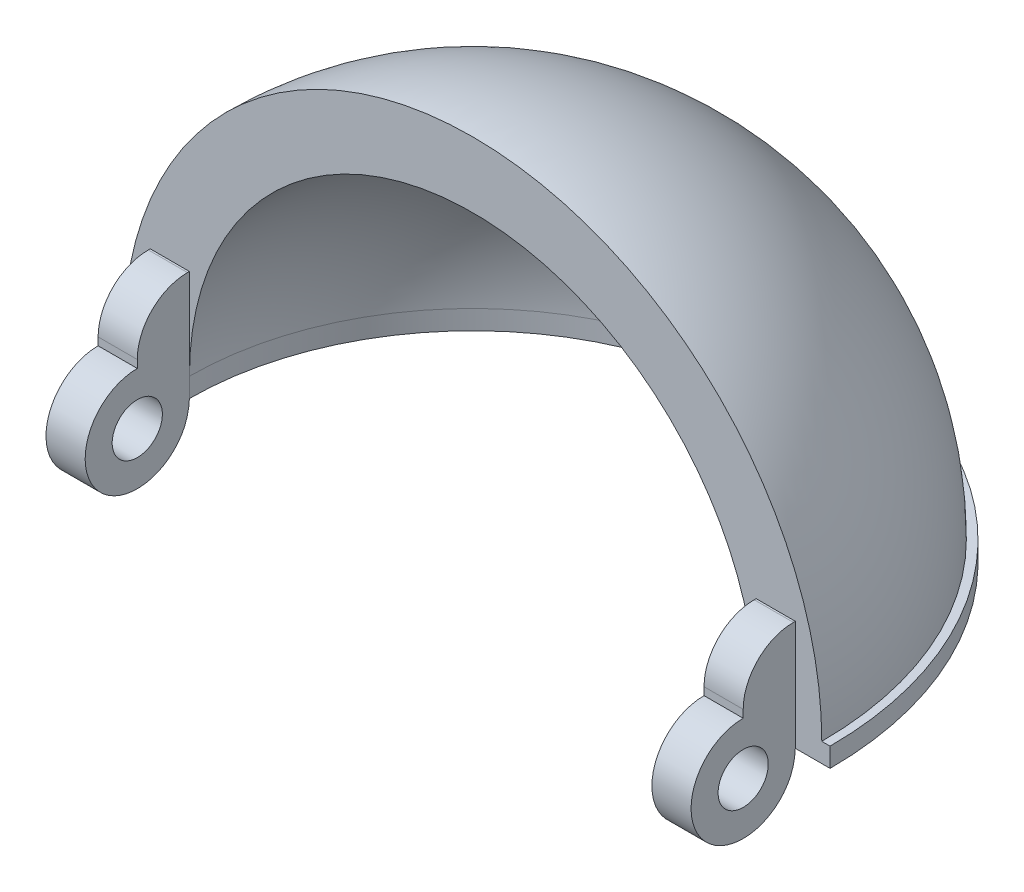
from build123d import *

# Parameters (mm, degrees)
BOSS_EXTRUDE1_DEPTH      = 1.27
REVOLVE3_ANGLE           = 90
SKETCH6_W                = 4.862612613
SKETCH6_H                = 1.27
BOSS_EXTRUDE3_DEPTH      = 7.935530078
BOSS_EXTRUDE4_DEPTH      = 3.81
BOSS_EXTRUDE4_DEPTH_BACK = 6.35
SKETCH10_W               = 4.862612613
SKETCH10_H               = 7.935530078
FILLET7_R                = 5.08
FILLET10_R               = 5.08
SKETCH13_R               = 1.651
CUT_EXTRUDE2_DEPTH       = 55.372
SKETCH14_W               = 2.286
SKETCH14_H               = 11.368095807
CUT_EXTRUDE3_DEPTH       = 55.372
FILLET15_RADIUS          = 3.967765039
FILLET15_LENGTH          = 2.576612613
FILLET16_RADIUS          = 3.967765039
FILLET16_LENGTH          = 2.576612613
CUT_EXTRUDE4_DEPTH       = 55.372
CUT_EXTRUDE7_DEPTH       = 55.88
SKETCH19_W               = 2.576612613
SKETCH19_H               = 3.428576371
BOSS_EXTRUDE5_DEPTH      = 3.81
FILLET17_R               = 3.302
FILLET18_R               = 3.302


with BuildPart() as part:
    # Sketch1 → Boss-Extrude1 (new body)
    with BuildSketch(Plane(origin=(0, 0, 0), x_dir=(1, 0, 0), z_dir=(0, 1, 0))):
        with BuildLine():
            Line((-18.44626818, 0), (-13.583655567, 0))
            ThreePointArc((-13.583655567, 0), (5.056359448, 18.640015015), (23.696374463, 0))
            Line((23.696374463, 0), (28.558987076, 0))
            ThreePointArc((28.558987076, 0), (5.056359448, 23.502627628), (-18.44626818, 0))
        make_face()
    extrude(amount=BOSS_EXTRUDE1_DEPTH)

    # Sketch4 → Revolve3 (revolve)
    with BuildSketch(Plane(origin=(0, 1.27, 0), x_dir=(1, 0, 0), z_dir=(0, 1, 0))):
        with BuildLine():
            Line((23.696374463, 0), (28.014374463, 0))
            ThreePointArc((28.014374463, 0), (5.056359448, 22.958015015), (-17.901655567, 0))
            Line((-17.901655567, 0), (-13.583655567, 0))
            ThreePointArc((-13.583655567, 0), (5.056359448, 18.640015015), (23.696374463, 0))
        make_face()
    revolve(axis=Axis((-17.901655567, 1.27, 0), (1, 0, 0)), revolution_arc=REVOLVE3_ANGLE)

    # Sketch6 → Boss-Extrude3 (add)
    with BuildSketch(Plane.XY):
        with Locations((-16.014961873, 0.635)):
            Rectangle(SKETCH6_W, SKETCH6_H)
        with Locations((26.12768077, 0.635)):
            Rectangle(SKETCH6_W, SKETCH6_H)
    extrude(amount=BOSS_EXTRUDE3_DEPTH)

    # Sketch10 → Boss-Extrude4 (add, two sides: drawn at the far end of the back side and taken through both)
    with BuildSketch(Plane(origin=(0, 1.27, 0), x_dir=(1, 0, 0), z_dir=(0, 1, 0)).offset(-BOSS_EXTRUDE4_DEPTH_BACK)):
        with Locations((-16.014961873, -3.967765039)):
            Rectangle(SKETCH10_W, SKETCH10_H)
        with Locations((26.12768077, -3.967765039)):
            Rectangle(SKETCH10_W, SKETCH10_H)
    extrude(amount=BOSS_EXTRUDE4_DEPTH + BOSS_EXTRUDE4_DEPTH_BACK)

    # Fillet7
    fillet7_edges = [part.edges().sort_by_distance(p)[0] for p in [
        (-16.014961873, 5.08, 7.935530078),
    ]]
    fillet(fillet7_edges, radius=FILLET7_R)

    # Fillet10
    fillet10_edges = [part.edges().sort_by_distance(p)[0] for p in [
        (26.127680769, 5.08, 7.935530078),
    ]]
    fillet(fillet10_edges, radius=FILLET10_R)

    # Sketch13 → Cut-Extrude2 (cut)
    with BuildSketch(Plane.ZY.offset(18.44626818)):
        with Locations((3.428576371, 0)):
            Circle(SKETCH13_R)
    extrude(amount=-CUT_EXTRUDE2_DEPTH, mode=Mode.SUBTRACT)

    # Sketch14 → Cut-Extrude3 (cut)
    with BuildSketch(Plane(origin=(0, 5.08, 0), x_dir=(1, 0, 0), z_dir=(0, 1, 0))):
        with Locations((27.415987076, -5.684047904)):
            Rectangle(SKETCH14_W, SKETCH14_H)
        with Locations((-17.30326818, -5.684047904)):
            Rectangle(SKETCH14_W, SKETCH14_H)
    extrude(amount=-CUT_EXTRUDE3_DEPTH, mode=Mode.SUBTRACT)

    # Fillet15: full round fillet: the end face becomes a half cylinder, R = half its width
    fillet15_face = Plane((24.984680769, -5.08, 3.967765039), x_dir=(1, 0, 0), z_dir=(0, -1, 0))  # on the end face: x along it, z out of the body
    fillet15_slab = fillet15_face.offset(-FILLET15_RADIUS / 2) * Box(FILLET15_LENGTH, 2 * FILLET15_RADIUS, FILLET15_RADIUS, mode=Mode.PRIVATE)  # the body's end, R deep
    fillet15_round = Plane((24.984680769, -1.112234961, 3.967765039), x_dir=(0, -1, 0), z_dir=(1, 0, 0)) * Cylinder(FILLET15_RADIUS, FILLET15_LENGTH, mode=Mode.PRIVATE)  # its axis R under the face
    add(fillet15_slab - fillet15_round, mode=Mode.SUBTRACT)

    # Fillet16: full round fillet: the end face becomes a half cylinder, R = half its width
    fillet16_face = Plane((-14.871961873, -5.08, 3.967765039), x_dir=(-1, 0, 0), z_dir=(0, -1, 0))  # on the end face: x along it, z out of the body
    fillet16_slab = fillet16_face.offset(-FILLET16_RADIUS / 2) * Box(FILLET16_LENGTH, 2 * FILLET16_RADIUS, FILLET16_RADIUS, mode=Mode.PRIVATE)  # the body's end, R deep
    fillet16_round = Plane((-14.871961873, -1.112234961, 3.967765039), x_dir=(0, -1, 0), z_dir=(-1, 0, 0)) * Cylinder(FILLET16_RADIUS, FILLET16_LENGTH, mode=Mode.PRIVATE)  # its axis R under the face
    add(fillet16_slab - fillet16_round, mode=Mode.SUBTRACT)

    # Sketch16 → Cut-Extrude4 (cut)
    with BuildSketch(Plane(origin=(26.272987076, 0, 0), x_dir=(0, 0, -1), z_dir=(1, 0, 0))):
        with BuildLine():
            ThreePointArc((0, 0), (-3.716578938, -3.862364093), (-7.935530078, -0.55611748))
            ThreePointArc((-7.935530078, -0.55611748), (-3.630565744, -5.089731167), (0, 0))
        make_face()
    extrude(amount=-CUT_EXTRUDE4_DEPTH, mode=Mode.SUBTRACT)

    # Sketch18 → Cut-Extrude7 (cut)
    with BuildSketch(Plane(origin=(26.272987076, 0, 0), x_dir=(0, 0, -1), z_dir=(1, 0, 0))):
        with BuildLine():
            Line((-3.428576371, 3.428576371), (0, 3.428576371))
            Line((0, 3.428576371), (0, 5.467356317))
            Line((0, 5.467356317), (-9.031573881, 5.467356317))
            Line((-9.031573881, 5.467356317), (-9.031573881, -4.486785293))
            Line((-9.031573881, -4.486785293), (0, -4.486785293))
            Line((0, -4.486785293), (0, 0))
            ThreePointArc((0, 0), (-5.852945973, -2.424369602), (-3.428576371, 3.428576371))
        make_face()
    extrude(amount=-CUT_EXTRUDE7_DEPTH, mode=Mode.SUBTRACT)

    # Sketch19 → Boss-Extrude5 (add)
    with BuildSketch(Plane(origin=(0, 3.428576371, 0), x_dir=(1, 0, 0), z_dir=(0, 1, 0))):
        with Locations((24.98468077, -1.714288186)):
            Rectangle(SKETCH19_W, SKETCH19_H)
        with Locations((-14.871961874, -1.714288186)):
            Rectangle(SKETCH19_W, SKETCH19_H)
    extrude(amount=BOSS_EXTRUDE5_DEPTH)

    # Fillet17
    fillet17_edges = [part.edges().sort_by_distance(p)[0] for p in [
        (24.984680769, 7.238576371, 3.428576371),
    ]]
    fillet(fillet17_edges, radius=FILLET17_R)

    # Fillet18
    fillet18_edges = [part.edges().sort_by_distance(p)[0] for p in [
        (-14.871961873, 7.238576371, 3.428576371),
    ]]
    fillet(fillet18_edges, radius=FILLET18_R)


solid = part.part
